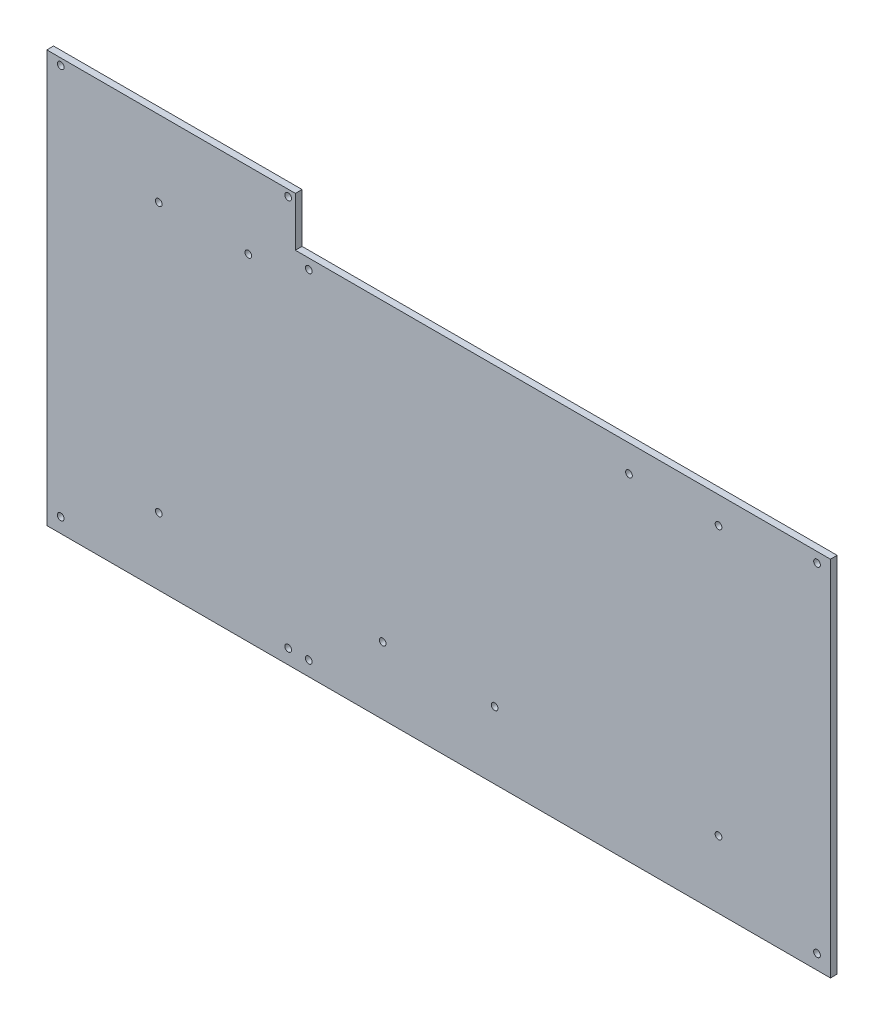
from build123d import *

# Parameters (mm, degrees)
SKETCH_1_R      = 1.5
EXTRUDE_1_DEPTH = 3


with BuildPart() as part:
    # 스케치1 → 보스-돌출1 (new body)
    with BuildSketch(Plane.XY):
        Polygon((-47.224852071, 90.964497041), (191.775147929, 90.964497041), (191.775147929, -71.035502959), (-158.224852071, -71.035502959), (-158.224852071, 90.964497041), (-158.224852071, 112.964497041), (-47.224852071, 112.964497041), align=None)
        with Locations((-108.224852071, 78.964497041)):
            Circle(SKETCH_1_R, mode=Mode.SUBTRACT)
        with Locations((-68.224852071, 78.964497041)):
            Circle(SKETCH_1_R, mode=Mode.SUBTRACT)
        with Locations((101.775147929, 78.964497041)):
            Circle(SKETCH_1_R, mode=Mode.SUBTRACT)
        with Locations((141.775147929, 78.964497041)):
            Circle(SKETCH_1_R, mode=Mode.SUBTRACT)
        with Locations((141.775147929, -41.035502959)):
            Circle(SKETCH_1_R, mode=Mode.SUBTRACT)
        with Locations((41.775147929, -41.035502959)):
            Circle(SKETCH_1_R, mode=Mode.SUBTRACT)
        with Locations((-8.224852071, -41.035502959)):
            Circle(SKETCH_1_R, mode=Mode.SUBTRACT)
        with Locations((-108.224852071, -41.035502959)):
            Circle(SKETCH_1_R, mode=Mode.SUBTRACT)
        with Locations((-152.024852071, 110.064497041)):
            Circle(SKETCH_1_R, mode=Mode.SUBTRACT)
        with Locations((-50.424852071, 110.064497041)):
            Circle(SKETCH_1_R, mode=Mode.SUBTRACT)
        with Locations((-41.224852071, 86.464497041)):
            Circle(SKETCH_1_R, mode=Mode.SUBTRACT)
        with Locations((185.775147929, 86.464497041)):
            Circle(SKETCH_1_R, mode=Mode.SUBTRACT)
        with Locations((185.775147929, -64.535502959)):
            Circle(SKETCH_1_R, mode=Mode.SUBTRACT)
        with Locations((-41.224852071, -64.535502959)):
            Circle(SKETCH_1_R, mode=Mode.SUBTRACT)
        with Locations((-50.424852071, -64.535502959)):
            Circle(SKETCH_1_R, mode=Mode.SUBTRACT)
        with Locations((-152.024852071, -64.535502959)):
            Circle(SKETCH_1_R, mode=Mode.SUBTRACT)
    extrude(amount=EXTRUDE_1_DEPTH)


solid = part.part
